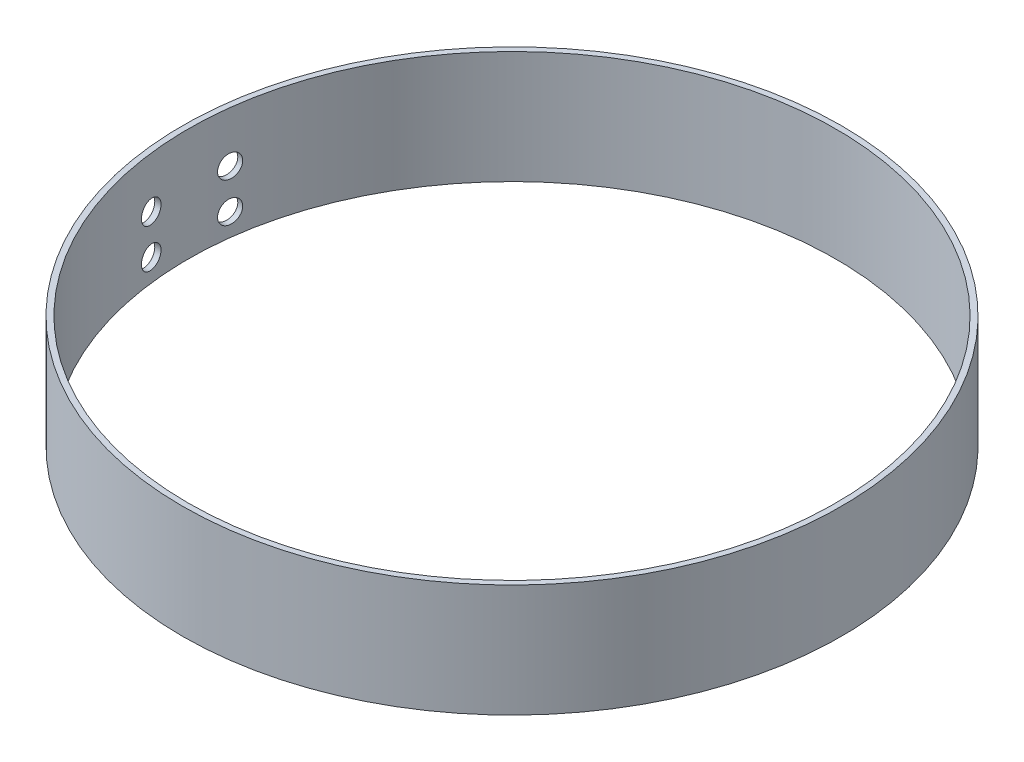
from build123d import *

# Parameters (mm, degrees)
SKETCH_1_R          = 58.5
SKETCH_1_R_2        = 57.5
EXTRUDE_1_DEPTH     = 20
SKETCH_3_R          = 2
CUT_EXTRUDE_1_DEPTH = 71
SKETCH_4_R          = 2
CUT_EXTRUDE_2_DEPTH = 71


with BuildPart() as part:
    # 草图1 → 凸台-拉伸1 (new body)
    with BuildSketch(Plane(origin=(0, 0, 0), x_dir=(1, 0, 0), z_dir=(0, 1, 0))):
        with Locations(Location((0, 0, 0), (0, 0, 270))):
            Circle(SKETCH_1_R)
        with Locations(Location((0, 0, 0), (0, 0, 270))):
            Circle(SKETCH_1_R_2, mode=Mode.SUBTRACT)
    extrude(amount=EXTRUDE_1_DEPTH)

    # 草图3 → 切除-拉伸1 (cut)
    with BuildSketch(Plane(origin=(0, 0, 0), x_dir=(-0.12186934340515121, 0, -0.9925461516413215), z_dir=(0.9925461516413215, 0, -0.12186934340515121))):
        with Locations((0, 11)):
            Circle(SKETCH_3_R)
        with Locations((0, 4)):
            Circle(SKETCH_3_R)
    extrude(amount=-CUT_EXTRUDE_1_DEPTH, mode=Mode.SUBTRACT)

    # 草图4 → 切除-拉伸2 (cut)
    with BuildSketch(Plane(origin=(0, 0, 0), x_dir=(0.12186934340514427, 0, -0.9925461516413224), z_dir=(0.9925461516413224, 0, 0.12186934340514427))):
        with Locations((0, 11)):
            Circle(SKETCH_4_R)
        with Locations((0, 4)):
            Circle(SKETCH_4_R)
    extrude(amount=-CUT_EXTRUDE_2_DEPTH, mode=Mode.SUBTRACT)


solid = part.part
